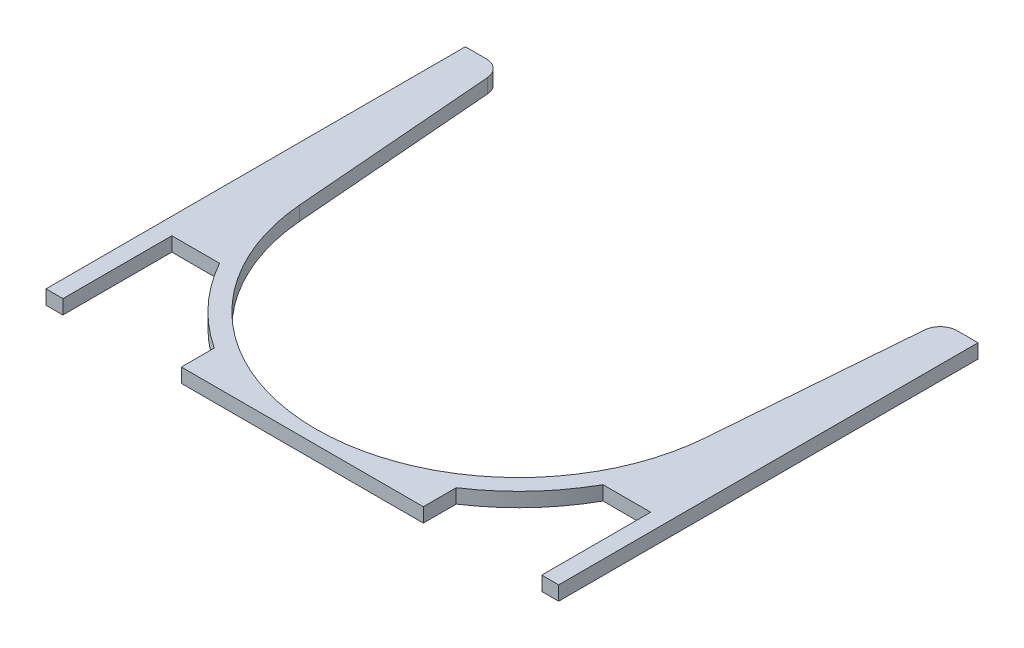
from build123d import *

# Parameters (mm, degrees)
SKETCH1_W             = 192.532
SKETCH1_H             = 157.48
BASE_DEPTH            = 5.334
CENTER_CUT_DEPTH      = 249.791022708
CENTER_CUT_DEPTH_BACK = 249.791022708
FILLET1_R             = 6.35
CUT_EXTRUDE3_DEPTH    = 249.791022708


with BuildPart() as part:
    # Sketch1 → Base (new body)
    with BuildSketch(Plane(origin=(0, 0, 0), x_dir=(1, 0, 0), z_dir=(0, 1, 0))):
        with Locations((96.266, 78.74)):
            Rectangle(SKETCH1_W, SKETCH1_H)
    extrude(amount=BASE_DEPTH)

    # Sketch2 → Center Cut (cut, two sides: drawn at the far end of the back side and taken through both)
    with BuildSketch(Plane(origin=(0, 5.334, 0), x_dir=(1, 0, 0), z_dir=(0, 1, 0)).offset(-CENTER_CUT_DEPTH_BACK)):
        with BuildLine():
            Line((217.68055776, 642.475883119), (178.816, 157.48))
            Line((178.816, 157.48), (172.200955719, 74.93))
            ThreePointArc((172.200955719, 74.93), (96.266, 5.08), (20.331044281, 74.93))
            Line((20.331044281, 74.93), (13.716, 157.48))
            Line((13.716, 157.48), (-25.14855776, 642.475883119))
            Line((-25.14855776, 642.475883119), (-25.14855776, 1615.577029953))
            Line((-25.14855776, 1615.577029953), (217.68055776, 1615.577029953))
            Line((217.68055776, 1615.577029953), (217.68055776, 642.475883119))
        make_face()
    extrude(amount=CENTER_CUT_DEPTH + CENTER_CUT_DEPTH_BACK, mode=Mode.SUBTRACT)

    # Fillet1
    fillet1_edges = [part.edges().sort_by_distance(p)[0] for p in [
        (178.816, 2.667, -157.48),
        (13.716, 2.667, -157.48),
    ]]
    fillet(fillet1_edges, radius=FILLET1_R)

    # Sketch7 → Cut-Extrude3 (cut, through all)
    with BuildSketch(Plane(origin=(0, 5.334, 0), x_dir=(1, 0, 0), z_dir=(0, 1, 0))):
        with BuildLine():
            Line((6.35, 40.9102037), (24.260569325, 40.9102037))
            ThreePointArc((24.260569325, 40.9102037), (35.834123486, 25.043972393), (50.827976512, 12.360564994))
            Line((50.827976512, 12.360564994), (50.827976512, 0))
            Line((50.827976512, 0), (6.35, 0))
            Line((6.35, 0), (6.35, 40.9102037))
        make_face()
        with BuildLine():
            Line((186.182, 40.9102037), (186.182, 0))
            Line((186.182, 0), (141.704023488, 0))
            Line((141.704023488, 0), (141.704023488, 12.360564994))
            ThreePointArc((141.704023488, 12.360564994), (156.697876514, 25.043972393), (168.271430675, 40.9102037))
            Line((168.271430675, 40.9102037), (186.182, 40.9102037))
        make_face()
    extrude(amount=-CUT_EXTRUDE3_DEPTH, mode=Mode.SUBTRACT)


solid = part.part
